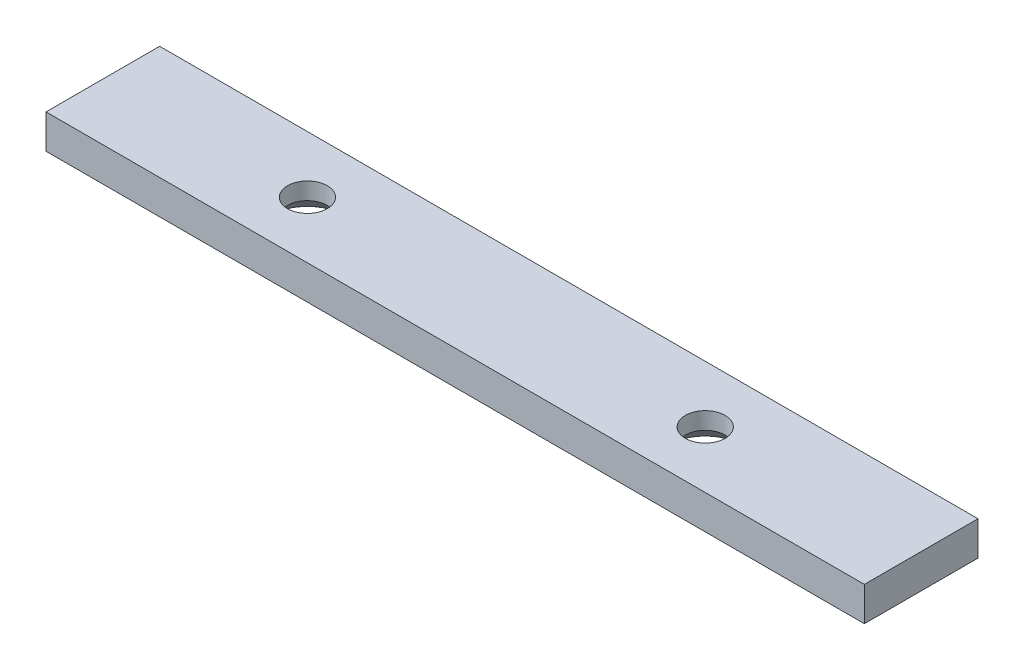
from build123d import *

# Parameters (mm, degrees)
SKETCH2_W           = 144
SKETCH2_H           = 20
BOSS_EXTRUDE1_DEPTH = 6
LPATTERN1_COUNT     = 2
LPATTERN1_PITCH     = 70


with BuildPart() as part:
    # Sketch2 → Boss-Extrude1 (new body)
    with BuildSketch(Plane(origin=(0, 0, 0), x_dir=(1, 0, 0), z_dir=(0, 1, 0))):
        Rectangle(SKETCH2_W, SKETCH2_H)
    extrude(amount=BOSS_EXTRUDE1_DEPTH)

    # Sketch3 → CSK for M2 Flat Head Machine Screw1 (revolve, cut)
    with BuildSketch(Plane(origin=(34, 0, 0), x_dir=(0, 0, -1), z_dir=(1, 0, 0))):
        Polygon((0, 0), (0, 6), (3.5, 6), (3.5, 3), (6.5, 0), align=None)
    csk_for_m2_flat_head_machine_screw1 = revolve(axis=Axis((34, -6.35, 0), (0, 1, 0)), mode=Mode.SUBTRACT)

    # LPattern1: CSK for M2 Flat Head Machine Screw1 ×2
    with Locations(*[(-i * LPATTERN1_PITCH, 0, 0) for i in range(1, LPATTERN1_COUNT)]):
        add(csk_for_m2_flat_head_machine_screw1, mode=Mode.SUBTRACT)


solid = part.part
